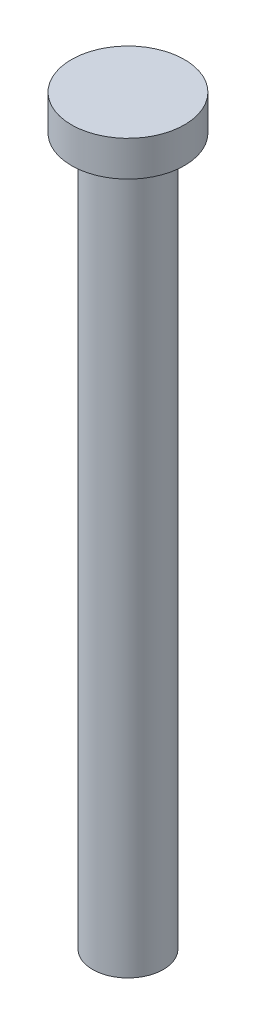
from build123d import *

# Parameters (mm, degrees)
ESQUISSE1_R     = 2.5
BASE_DEPTH      = 50
ESQUISSE2_R     = 4
BOSS_TETE_DEPTH = 2.5


with BuildPart() as part:
    # Esquisse1 → BASE (new body)
    with BuildSketch(Plane(origin=(0, 0, 0), x_dir=(1, 0, 0), z_dir=(0, 1, 0))):
        with Locations(Location((0, 0, 0), (0, 0, 270))):
            Circle(ESQUISSE1_R)
    extrude(amount=-BASE_DEPTH)

    # Esquisse2 → BOSS TETE (add)
    with BuildSketch(Plane(origin=(0, 0, 0), x_dir=(1, 0, 0), z_dir=(0, 1, 0))):
        with Locations(Location((0, 0, 0), (0, 0, 270))):
            Circle(ESQUISSE2_R)
    extrude(amount=BOSS_TETE_DEPTH)


solid = part.part
